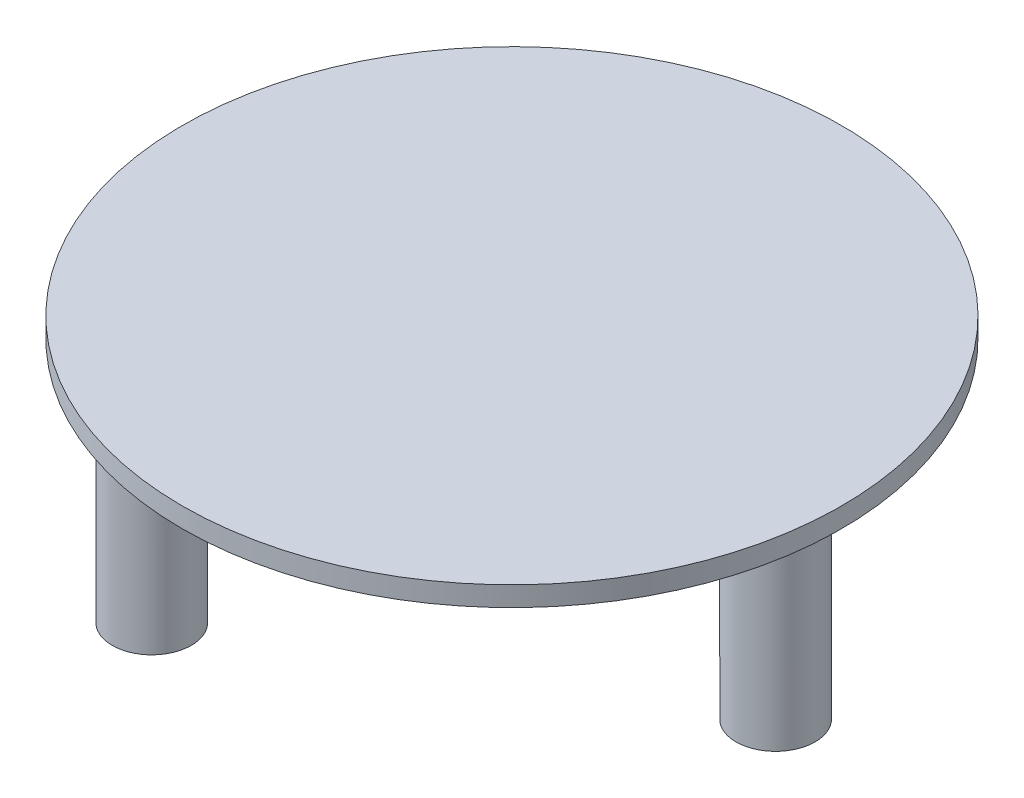
from build123d import *

# Parameters (mm, degrees)
SKETCH1_R           = 250
BOSS_EXTRUDE1_DEPTH = 15
SKETCH2_R           = 30
BOSS_EXTRUDE2_DEPTH = 150
CIRPATTERN1_COUNT   = 3


with BuildPart() as part:
    # Sketch1 → Boss-Extrude1 (new body)
    with BuildSketch(Plane(origin=(0, 0, 0), x_dir=(1, 0, 0), z_dir=(0, 1, 0))):
        with Locations(Location((0, 0, 0), (0, 0, 270))):
            Circle(SKETCH1_R)
    extrude(amount=BOSS_EXTRUDE1_DEPTH)

    # Sketch2 → Boss-Extrude2 (add)
    with BuildSketch(Plane.XZ):
        with Locations(Location((200, 0, 0), (0, 0, 90))):
            Circle(SKETCH2_R)
    boss_extrude2 = extrude(amount=BOSS_EXTRUDE2_DEPTH)

    # CirPattern1: Boss-Extrude2 ×3 about axis
    cirpattern1_axis = Axis((0, 0, 0), (0, 1, 0))
    for i in range(1, CIRPATTERN1_COUNT):
        add(boss_extrude2.rotate(cirpattern1_axis, i * 360 / CIRPATTERN1_COUNT))


solid = part.part
